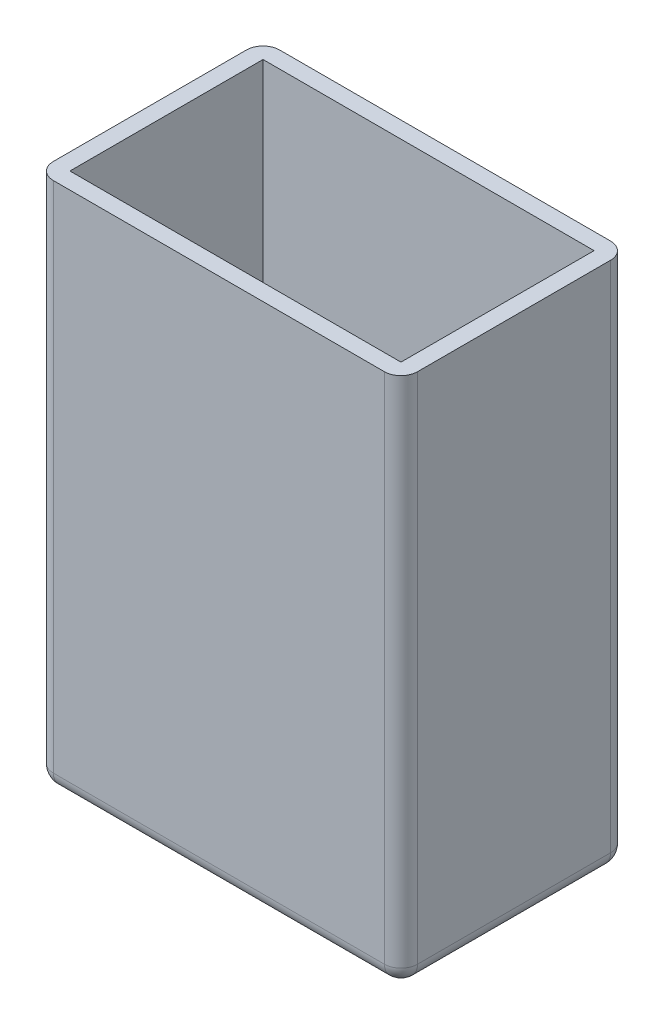
from build123d import *

# Parameters (mm, degrees)
IZIM1_W                     = 90
IZIM1_H                     = 60
Y_KSEKLIK_EKSTR_ZYON1_DEPTH = 3
IZIM2_W                     = 96
IZIM2_H                     = 66
IZIM2_W_2                   = 90
IZIM2_H_2                   = 60
Y_KSEKLIK_EKSTR_ZYON2_DEPTH = 38
IZIM3_W                     = 60
IZIM3_H                     = 3
KES_EKSTR_ZYON1_DEPTH       = 35
IZIM4_W                     = 66
IZIM4_H                     = 96
Y_KSEKLIK_EKSTR_ZYON3_DEPTH = 3
RADYUS4_R                   = 3
RADYUS5_R                   = 3
RADYUS6_R                   = 3
RADYUS7_R                   = 3


with BuildPart() as part:
    # Çizim1 → Yükseklik-Ekstrüzyon1 (new body)
    with BuildSketch(Plane(origin=(0, 0, 0), x_dir=(0, 1, 0), z_dir=(0, 0, 1))):
        with Locations((45, -30)):
            Rectangle(IZIM1_W, IZIM1_H)
    extrude(amount=Y_KSEKLIK_EKSTR_ZYON1_DEPTH)

    # Çizim2 → Yükseklik-Ekstrüzyon2 (add)
    with BuildSketch(Plane(origin=(0, 0, 0), x_dir=(0, 1, 0), z_dir=(0, 0, 1))):
        with Locations((45, -30)):
            Rectangle(IZIM2_W, IZIM2_H)
        with Locations((45, -30)):
            Rectangle(IZIM2_W_2, IZIM2_H_2, mode=Mode.SUBTRACT)
    extrude(amount=Y_KSEKLIK_EKSTR_ZYON2_DEPTH)

    # Çizim3 → Kes-Ekstrüzyon1 (cut)
    with BuildSketch(Plane.XY.offset(38)):
        with Locations((30, 91.5)):
            Rectangle(IZIM3_W, IZIM3_H)
    extrude(amount=-KES_EKSTR_ZYON1_DEPTH, mode=Mode.SUBTRACT)

    # Çizim4 → Yükseklik-Ekstrüzyon3 (add)
    with BuildSketch(Plane.XY.offset(38)):
        with Locations((30, 45)):
            Rectangle(IZIM4_W, IZIM4_H)
    extrude(amount=Y_KSEKLIK_EKSTR_ZYON3_DEPTH)

    # Radyus4
    radyus4_edges = [part.edges().sort_by_distance(p)[0] for p in [
        (-3, -3, 20.5),
    ]]
    fillet(radyus4_edges, radius=RADYUS4_R)

    # Radyus5
    radyus5_edges = [part.edges().sort_by_distance(p)[0] for p in [
        (63, -3, 20.5),
    ]]
    fillet(radyus5_edges, radius=RADYUS5_R)

    # Radyus6
    radyus6_edges = [part.edges().sort_by_distance(p)[0] for p in [
        (-3, 46.5, 41),
        (30, -3, 41),
        (-2.121320344, -2.121320344, 41),
        (63, 46.5, 41),
        (62.121320344, -2.121320344, 41),
    ]]
    fillet(radyus6_edges, radius=RADYUS6_R)

    # Radyus7
    radyus7_edges = [part.edges().sort_by_distance(p)[0] for p in [
        (-3, 46.5, 0),
        (30, -3, 0),
        (-2.121320344, -2.121320344, 0),
        (63, 46.5, 0),
        (62.121320344, -2.121320344, 0),
    ]]
    fillet(radyus7_edges, radius=RADYUS7_R)


solid = part.part
